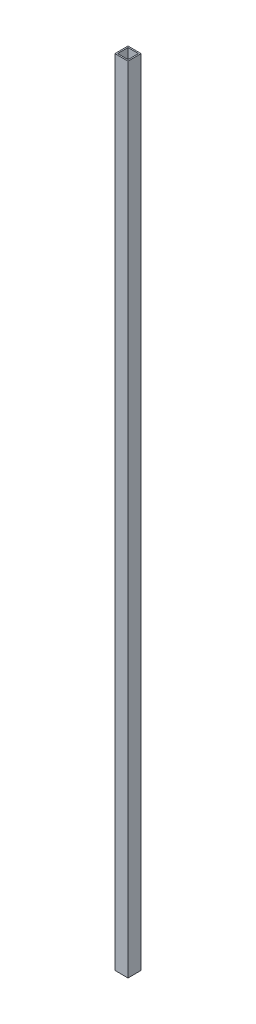
from build123d import *

# Parameters (mm, degrees)
SKETCH_1_W          = 10
SKETCH_1_H          = 10
SKETCH_1_W_2        = 8
SKETCH_1_H_2        = 8
EXTRUDE_1_DEPTH     = 605
CUT_EXTRUDE_1_REACH = 607.103
SKETCH_2_R          = 2.7


with BuildPart() as part:
    # Эскиз1 → Бобышка-Вытянуть1 (new body)
    with BuildSketch(Plane(origin=(0, 0, 0), x_dir=(1, 0, 0), z_dir=(0, 1, 0))):
        Rectangle(SKETCH_1_W, SKETCH_1_H)
        Rectangle(SKETCH_1_W_2, SKETCH_1_H_2, mode=Mode.SUBTRACT)
    extrude(amount=EXTRUDE_1_DEPTH)

    # Эскиз2 → Вырез-Вытянуть1 (cut, up to next)
    with BuildSketch(Plane.ZY.offset(5), mode=Mode.PRIVATE) as cut_extrude_1_sk1:
        with Locations((0, 17.5)):
            Circle(SKETCH_2_R)
    cut_extrude_1_tool1 = extrude(cut_extrude_1_sk1.sketch, amount=-CUT_EXTRUDE_1_REACH, mode=Mode.PRIVATE) & part.part
    # Эскиз2 → Вырез-Вытянуть1 (cut, up to next)
    with BuildSketch(Plane.ZY.offset(5), mode=Mode.PRIVATE) as cut_extrude_1_sk2:
        with Locations((0, 587.5)):
            Circle(SKETCH_2_R)
    cut_extrude_1_tool2 = extrude(cut_extrude_1_sk2.sketch, amount=-CUT_EXTRUDE_1_REACH, mode=Mode.PRIVATE) & part.part
    add(cut_extrude_1_tool1.solids().sort_by_distance((-5, 17.5, 0))[0], mode=Mode.SUBTRACT)
    add(cut_extrude_1_tool2.solids().sort_by_distance((-5, 587.5, 0))[0], mode=Mode.SUBTRACT)


solid = part.part
